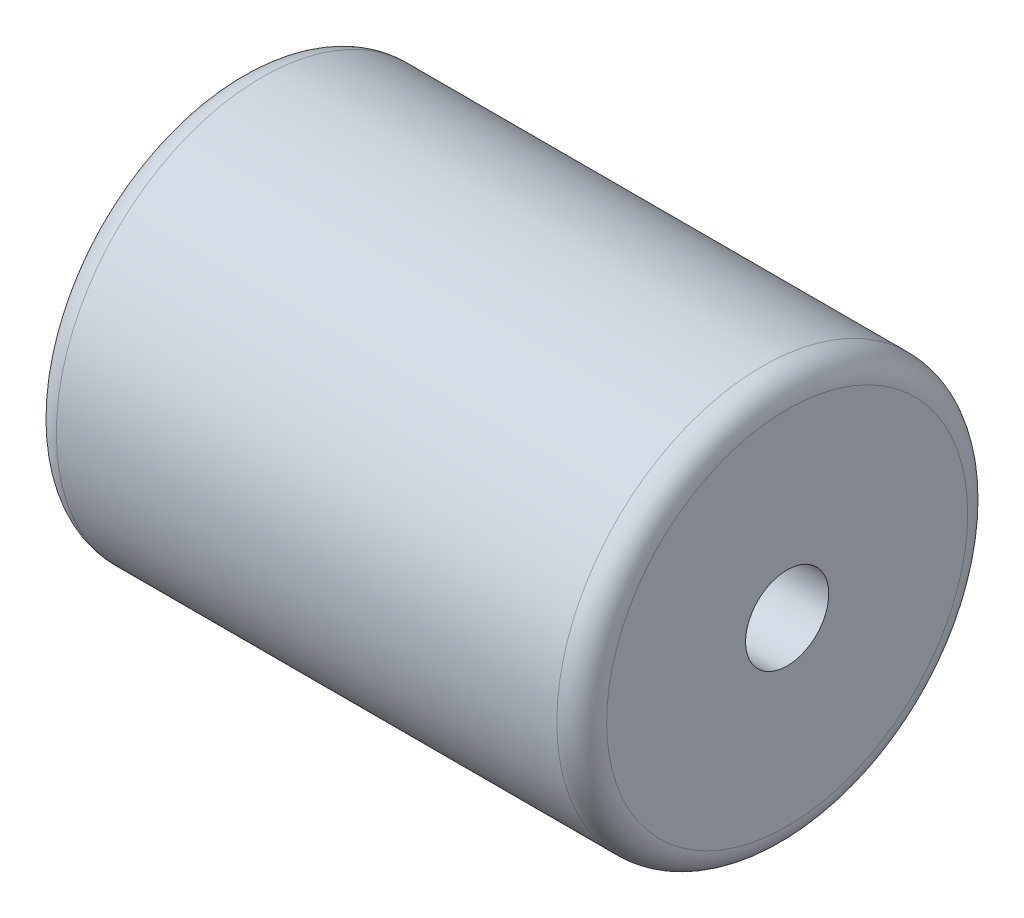
from build123d import *

# Parameters (mm, degrees)
SKETCH1_R           = 5.23875
SKETCH1_R_2         = 1.06045
BOSS_EXTRUDE1_DEPTH = 14.0335
FILLET1_R           = 0.635


with BuildPart() as part:
    # Sketch1 → Boss-Extrude1 (new body)
    with BuildSketch(Plane(origin=(0, 0, 0), x_dir=(0, 0, -1), z_dir=(1, 0, 0))):
        Circle(SKETCH1_R)
        Circle(SKETCH1_R_2, mode=Mode.SUBTRACT)
    extrude(amount=BOSS_EXTRUDE1_DEPTH)

    # Fillet1
    fillet1_edges = [part.edges().sort_by_distance(p)[0] for p in [
        (0, 0, 5.23875),
        (14.0335, 0, 5.23875),
    ]]
    fillet(fillet1_edges, radius=FILLET1_R)


solid = part.part
